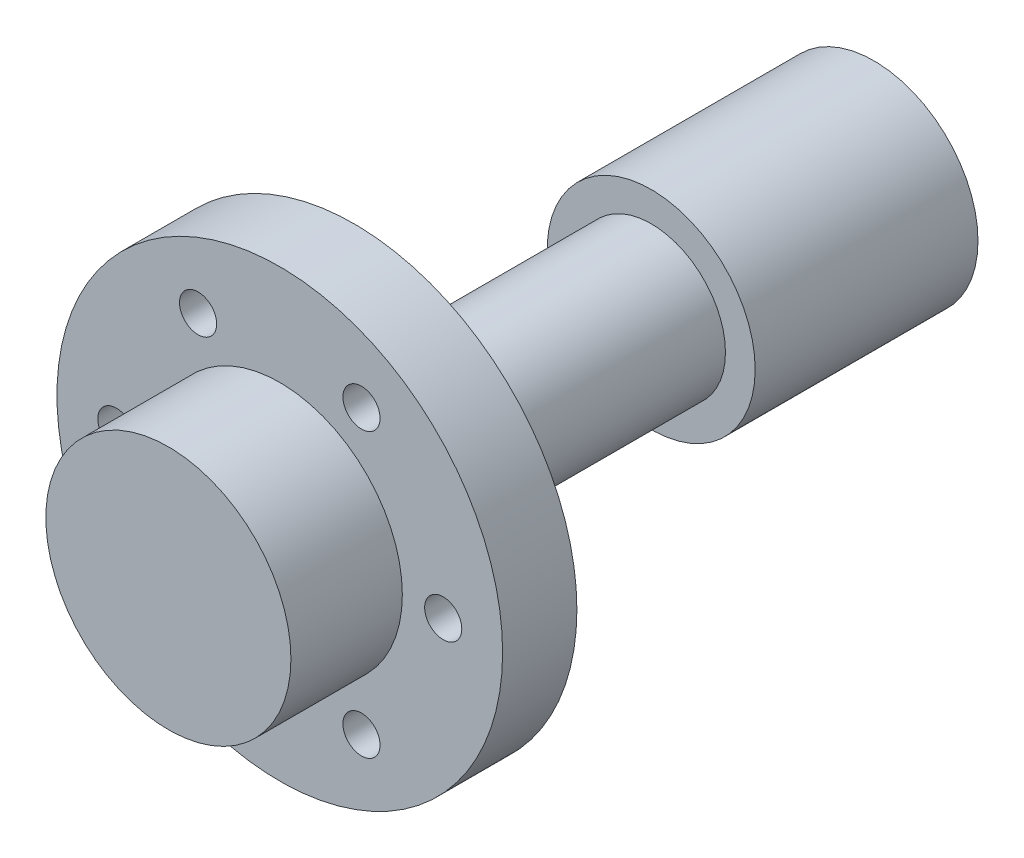
from build123d import *

# Parameters (mm, degrees)
SCHIZZO1_R                   = 14
ESTRUSIONE_ESTRUSIONE1_DEPTH = 30
SCHIZZO2_R                   = 10
ESTRUSIONE_ESTRUSIONE2_DEPTH = 40
SCHIZZO3_R                   = 30
ESTRUSIONE_ESTRUSIONE3_DEPTH = 10
SCHIZZO4_R                   = 16.5
ESTRUSIONE_ESTRUSIONE4_DEPTH = 15
SCHIZZO5_R                   = 7
TAGLIO_ESTRUSIONE1_DEPTH     = 25
SCHIZZO6_R                   = 2.5
TAGLIO_ESTRUSIONE2_DEPTH     = 10


with BuildPart() as part:
    # Schizzo1 → Estrusione-Estrusione1 (new body)
    with BuildSketch(Plane.XY):
        Circle(SCHIZZO1_R)
    extrude(amount=ESTRUSIONE_ESTRUSIONE1_DEPTH)

    # Schizzo2 → Estrusione-Estrusione2 (add)
    with BuildSketch(Plane.XY.offset(30)):
        Circle(SCHIZZO2_R)
    extrude(amount=ESTRUSIONE_ESTRUSIONE2_DEPTH)

    # Schizzo3 → Estrusione-Estrusione3 (add)
    with BuildSketch(Plane.XY.offset(70)):
        Circle(SCHIZZO3_R)
    extrude(amount=ESTRUSIONE_ESTRUSIONE3_DEPTH)

    # Schizzo4 → Estrusione-Estrusione4 (add)
    with BuildSketch(Plane.XY.offset(80)):
        Circle(SCHIZZO4_R)
    extrude(amount=ESTRUSIONE_ESTRUSIONE4_DEPTH)

    # Schizzo5 → Taglio-Estrusione1 (cut)
    with BuildSketch(Plane(origin=(0, 0, 0), x_dir=(-1, 0, 0), z_dir=(0, 0, -1))):
        Circle(SCHIZZO5_R)
    extrude(amount=-TAGLIO_ESTRUSIONE1_DEPTH, mode=Mode.SUBTRACT)

    # Schizzo6 → Taglio-Estrusione2 (cut)
    with BuildSketch(Plane.XY.offset(80)):
        with Locations((22, 0)):
            Circle(SCHIZZO6_R)
        with Locations((11, 19.052558883)):
            Circle(SCHIZZO6_R)
        with Locations((-11, 19.052558883)):
            Circle(SCHIZZO6_R)
        with Locations((-22, 0)):
            Circle(SCHIZZO6_R)
        with Locations((-11, -19.052558883)):
            Circle(SCHIZZO6_R)
        with Locations((11, -19.052558883)):
            Circle(SCHIZZO6_R)
    extrude(amount=-TAGLIO_ESTRUSIONE2_DEPTH, mode=Mode.SUBTRACT)


solid = part.part
